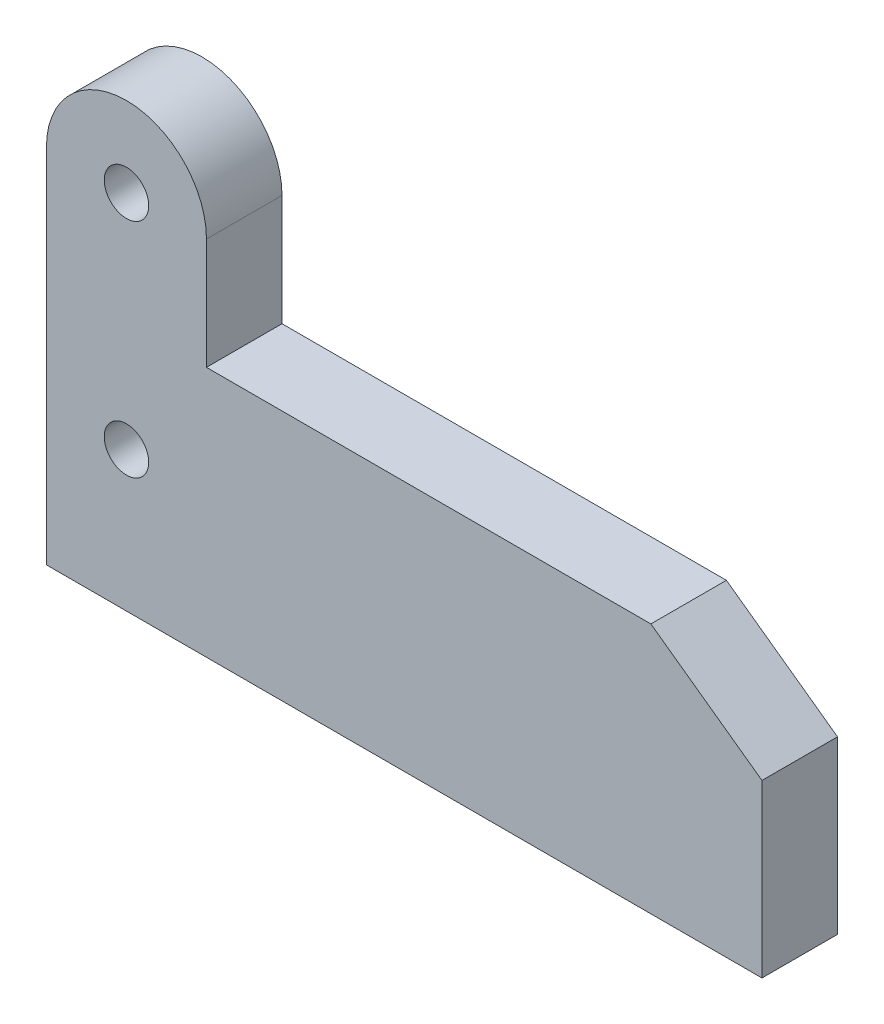
from build123d import *

# Parameters (mm, degrees)
CROQUIS1_R              = 1
SALIENTE_EXTRUIR1_DEPTH = 1.7
CROQUIS3_W              = 15
CROQUIS3_H              = 10.99
SALIENTE_EXTRUIR2_DEPTH = 3.4
CROQUIS4_W              = 15
CROQUIS4_H              = 3.4
CORTAR_EXTRUIR1_DEPTH   = 10.99
SALIENTE_EXTRUIR3_DEPTH = 3.4


with BuildPart() as part:
    # Croquis1 → Saliente-Extruir1 (new, symmetric)
    with BuildSketch(Plane.XY):
        with BuildLine():
            Line((-3.6, 0), (-3.6, -10))
            ThreePointArc((-3.6, -10), (-2.545584412, -12.545584412), (0, -13.6))
            Line((0, -13.6), (28.6, -13.6))
            Line((28.6, -13.6), (28.6, -8.6))
            Line((28.6, -8.6), (23.6, -5))
            Line((23.6, -5), (3.6, -5))
            Line((3.6, -5), (3.6, 0))
            ThreePointArc((3.6, 0), (0, 3.6), (-3.6, 0))
        make_face()
        Circle(CROQUIS1_R, mode=Mode.SUBTRACT)
        with Locations((0, -10)):
            Circle(CROQUIS1_R, mode=Mode.SUBTRACT)
    extrude(amount=SALIENTE_EXTRUIR1_DEPTH, both=True)

    # Croquis3 → Saliente-Extruir2 (add)
    with BuildSketch(Plane(origin=(0, 0, -1.7), x_dir=(-1, 0, 0), z_dir=(0, 0, -1))):
        with Locations((-21.1, -19.095)):
            Rectangle(CROQUIS3_W, CROQUIS3_H)
    extrude(amount=-SALIENTE_EXTRUIR2_DEPTH)

    # Croquis4 → Cortar-Extruir1 (cut)
    with BuildSketch(Plane.XZ.offset(24.59)):
        with Locations((21.1, 0)):
            Rectangle(CROQUIS4_W, CROQUIS4_H)
    extrude(amount=-CORTAR_EXTRUIR1_DEPTH, mode=Mode.SUBTRACT)

    # Croquis5 → Saliente-Extruir3 (add)
    with BuildSketch(Plane.XY.offset(1.7)):
        with BuildLine():
            Line((28.6, -13.6), (28.6, -16.3))
            Line((28.6, -16.3), (-3.6, -16.3))
            Line((-3.6, -16.3), (-3.6, -10))
            ThreePointArc((-3.6, -10), (-2.545584412, -12.545584412), (0, -13.6))
            Line((0, -13.6), (28.6, -13.6))
        make_face()
    extrude(amount=-SALIENTE_EXTRUIR3_DEPTH)


solid = part.part
